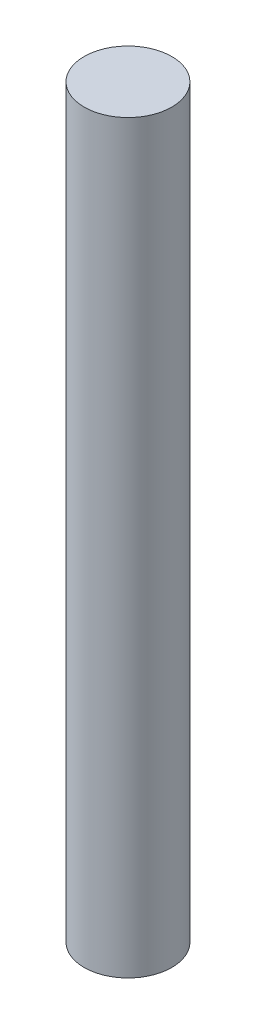
from build123d import *

# Parameters (mm, degrees)
SKETCH_1_R      = 1.5
EXTRUDE_1_DEPTH = 25.5


with BuildPart() as part:
    # 스케치1 → 보스-돌출1 (new body)
    with BuildSketch(Plane(origin=(0, 0, 0), x_dir=(1, 0, 0), z_dir=(0, 1, 0))):
        with Locations(Location((0, 0, 0), (0, 0, 270))):
            Circle(SKETCH_1_R)
    extrude(amount=EXTRUDE_1_DEPTH)


solid = part.part
